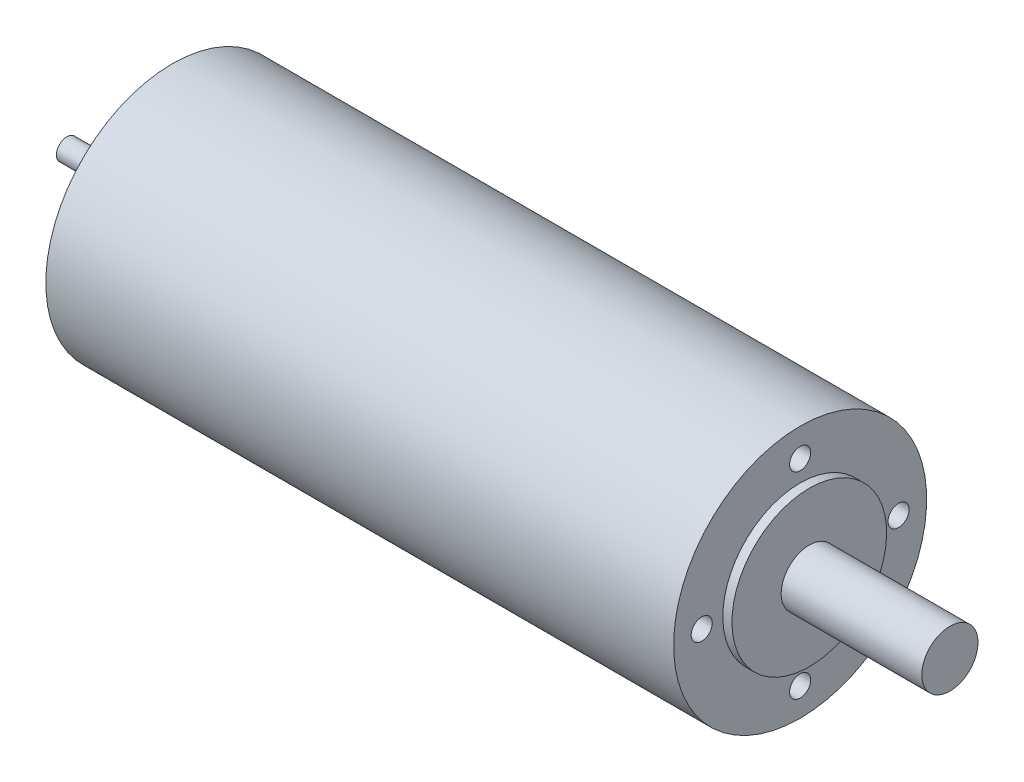
from build123d import *

# Parameters (mm, degrees)
SKETCH2_R          = 1.5
CUT_EXTRUDE1_DEPTH = 10


with BuildPart() as part:
    # Sketch1 → Revolve1 (revolve)
    with BuildSketch(Plane.XY):
        Polygon((-15, 0), (0, 0), (0, 12), (-4, 12), (-4, 1.5), (-15, 1.5), align=None)
        Polygon((110.6, 0), (0, 0), (0, 18), (89.3, 18), (89.3, 11), (90.6, 11), (90.6, 4), (110.6, 4), align=None)
    revolve(axis=Axis((110.6, 0, 0), (-1, 0, 0)))

    # Sketch2 → Cut-Extrude1 (cut)
    with BuildSketch(Plane(origin=(89.3, 0, 0), x_dir=(0, 0, -1), z_dir=(1, 0, 0))):
        with Locations(Location((0, 14, 0), (0, 0, 90))):
            Circle(SKETCH2_R)
        with Locations(Location((14, 0, 0), (0, 0, 90))):
            Circle(SKETCH2_R)
        with Locations(Location((0, -14, 0), (0, 0, 90))):
            Circle(SKETCH2_R)
        with Locations(Location((-14, 0, 0), (0, 0, 90))):
            Circle(SKETCH2_R)
    extrude(amount=-CUT_EXTRUDE1_DEPTH, mode=Mode.SUBTRACT)


solid = part.part
